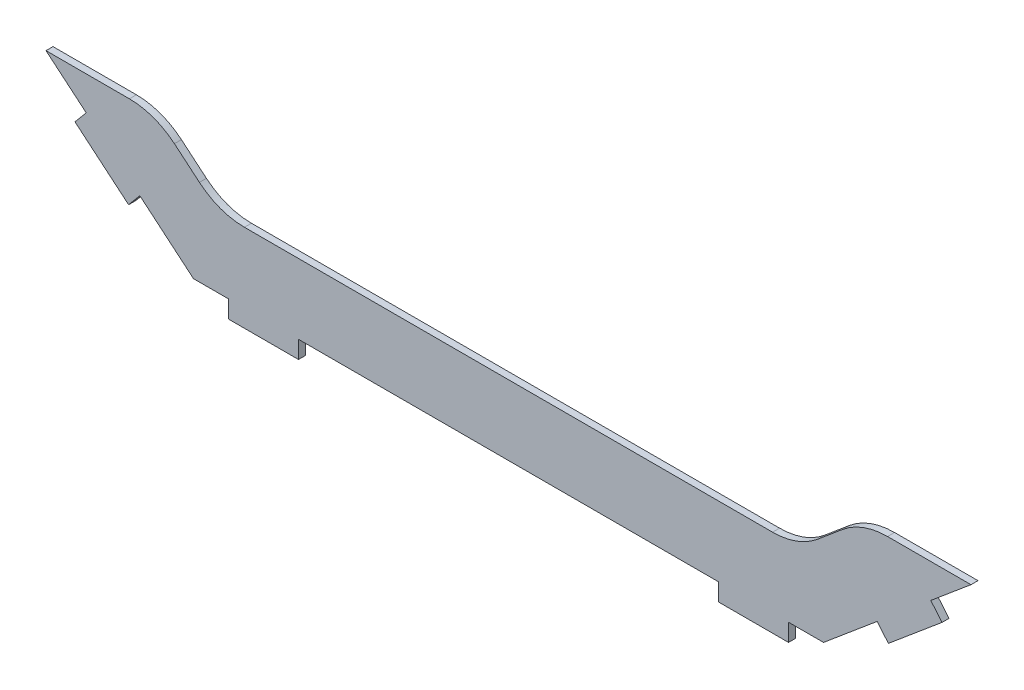
from build123d import *

# Parameters (mm, degrees)
BOSS_EXTRUDE1_DEPTH = 0.05
FILLET1_R           = 1


with BuildPart() as part:
    # frame_outline → Boss-Extrude1 (new, symmetric)
    with BuildSketch(Plane.XY):
        Polygon((0, 0), (3, 0), (3, -0.25), (4, -0.25), (4, 0), (4.5, 0), (5.266044443, 0.64278761), (5.426741346, 0.451276499), (6.192785789, 1.094064109), (6.032088886, 1.285575219), (6.606622219, 1.767665927), (5.050898392, 1.767665927), (4.136029766, 1), (-4.136029766, 1), (-5.050898392, 1.767665927), (-6.606622219, 1.767665927), (-6.032088886, 1.285575219), (-6.192785789, 1.094064109), (-5.426741346, 0.451276499), (-5.266044443, 0.64278761), (-4.5, 0), (-4, 0), (-4, -0.25), (-3, -0.25), (-3, 0), align=None)
    extrude(amount=BOSS_EXTRUDE1_DEPTH, both=True)

    # Fillet1
    fillet1_edges = [part.edges().sort_by_distance(p)[0] for p in [
        (-5.050898392, 1.767665927, 0),
        (-4.136029766, 1, 0),
        (4.136029766, 1, 0),
        (5.050898392, 1.767665927, 0),
    ]]
    fillet(fillet1_edges, radius=FILLET1_R)


solid = part.part
